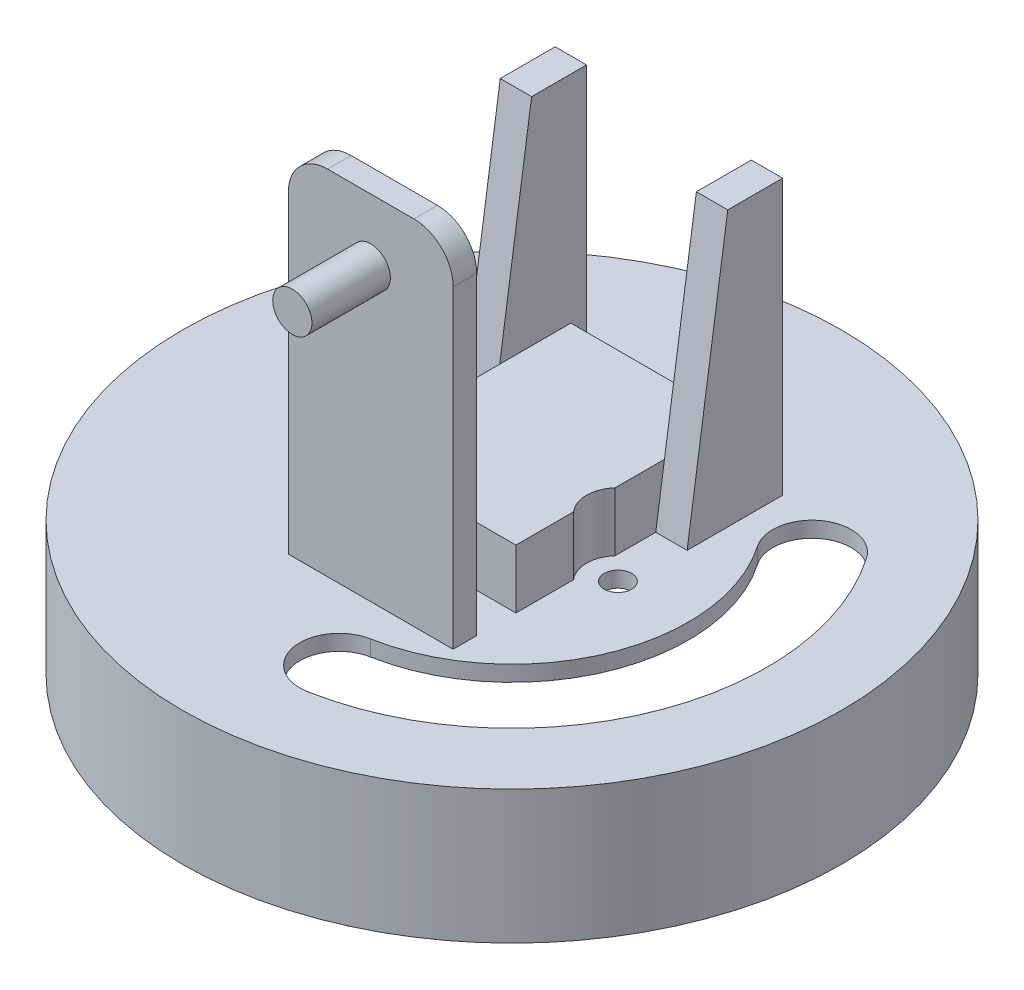
from build123d import *

# Parameters (mm, degrees)
IZIM1_R                     = 42
IZIM1_R_2                   = 40
Y_KSEKLIK_EKSTR_ZYON1_DEPTH = 15
IZIM2_R                     = 42
Y_KSEKLIK_EKSTR_ZYON2_DEPTH = 2
IZIM3_R                     = 1.75
KES_EKSTR_ZYON1_DEPTH       = 2
KES_EKSTR_ZYON2_DEPTH       = 2
Y_KSEKLIK_EKSTR_ZYON3_DEPTH = 7.5
Y_KSEKLIK_EKSTR_ZYON4_DEPTH = 35
Y_KSEKLIK_EKSTR_ZYON5_DEPTH = 4
Y_KSEKLIK_EKSTR_ZYON6_DEPTH = 4
IZIM9_W                     = 21
IZIM9_H                     = 3
Y_KSEKLIK_EKSTR_ZYON7_DEPTH = 45
IZIM10_R                    = 2.5
Y_KSEKLIK_EKSTR_ZYON8_DEPTH = 10
RADYUS1_R                   = 5


with BuildPart() as part:
    # Çizim1 → Yükseklik-Ekstrüzyon1 (new body)
    with BuildSketch(Plane(origin=(0, 0, 0), x_dir=(1, 0, 0), z_dir=(0, 1, 0))):
        with Locations(Location((0, 0, 0), (0, 0, 270))):
            Circle(IZIM1_R)
        with Locations(Location((0, 0, 0), (0, 0, 270))):
            Circle(IZIM1_R_2, mode=Mode.SUBTRACT)
    extrude(amount=Y_KSEKLIK_EKSTR_ZYON1_DEPTH)

    # Çizim2 → Yükseklik-Ekstrüzyon2 (add)
    with BuildSketch(Plane(origin=(0, 15, 0), x_dir=(1, 0, 0), z_dir=(0, 1, 0))):
        with Locations(Location((0, 0, 0), (0, 0, 270))):
            Circle(IZIM2_R)
    extrude(amount=Y_KSEKLIK_EKSTR_ZYON2_DEPTH)

    # Çizim3 → Kes-Ekstrüzyon1 (cut)
    with BuildSketch(Plane(origin=(0, 17, 0), x_dir=(1, 0, 0), z_dir=(0, 1, 0))):
        with Locations(Location((-13.5, 0, 0), (0, 0, 270))):
            Circle(IZIM3_R)
        with Locations(Location((13.5, 0, 0), (0, 0, 270))):
            Circle(IZIM3_R)
    extrude(amount=-KES_EKSTR_ZYON1_DEPTH, mode=Mode.SUBTRACT)

    # Çizim4 → Kes-Ekstrüzyon2 (cut)
    with BuildSketch(Plane(origin=(0, 17, 0), x_dir=(1, 0, 0), z_dir=(0, 1, 0))):
        with BuildLine():
            ThreePointArc((19.121323176, 19.121323176), (23.11330853, 20.564910887), (26.776285642, 18.419569137))
            ThreePointArc((26.776285642, 18.419569137), (30.026084807, -12.437211552), (5.909090909, -31.958295396))
            ThreePointArc((5.909090909, -31.958295396), (1.801989255, -30.88516514), (0, -27.041634566))
            ThreePointArc((0, -27.041634566), (1.156469426, -23.843623821), (4.090909091, -22.124973736))
            ThreePointArc((4.090909091, -22.124973736), (20.787289482, -8.610377228), (18.537428522, 12.752009403))
            ThreePointArc((18.537428522, 12.752009403), (17.677735465, 16.042240718), (19.121323176, 19.121323176))
        make_face()
    extrude(amount=-KES_EKSTR_ZYON2_DEPTH, mode=Mode.SUBTRACT)

    # Çizim5 → Yükseklik-Ekstrüzyon3 (add)
    with BuildSketch(Plane(origin=(0, 17, 0), x_dir=(1, 0, 0), z_dir=(0, 1, 0))):
        with BuildLine():
            Line((-10.5, -10), (-10.5, -2.645751311))
            ThreePointArc((-10.5, -2.645751311), (-9.5, 0), (-10.5, 2.645751311))
            Line((-10.5, 2.645751311), (-10.5, 18))
            Line((-10.5, 18), (10.5, 18))
            Line((10.5, 18), (10.5, 2.645751311))
            ThreePointArc((10.5, 2.645751311), (9.5, 0), (10.5, -2.645751311))
            Line((10.5, -2.645751311), (10.5, -10))
            Line((10.5, -10), (-10.5, -10))
        make_face()
    extrude(amount=Y_KSEKLIK_EKSTR_ZYON3_DEPTH)

    # Çizim6 → Yükseklik-Ekstrüzyon4 (add)
    with BuildSketch(Plane(origin=(0, 17, 0), x_dir=(1, 0, 0), z_dir=(0, 1, 0))):
        Polygon((-10.5, 18), (-10.5, 13), (-14.5, 13), (-14.5, 20), (-10.5, 20), align=None)
        Polygon((10.5, 20), (10.5, 18), (10.5, 13), (14.5, 13), (14.5, 20), align=None)
    extrude(amount=Y_KSEKLIK_EKSTR_ZYON4_DEPTH)

    # Çizim7 → Yükseklik-Ekstrüzyon5 (add)
    with BuildSketch(Plane(origin=(10.5, 0, 0), x_dir=(0, 0, -1), z_dir=(1, 0, 0))):
        Polygon((13, 52), (7.822875656, 17), (13, 17), align=None)
    extrude(amount=Y_KSEKLIK_EKSTR_ZYON5_DEPTH)

    # Çizim8 → Yükseklik-Ekstrüzyon6 (add)
    with BuildSketch(Plane.ZY.offset(10.5)):
        Polygon((-13, 52), (-7.822875656, 17), (-13, 17), align=None)
    extrude(amount=Y_KSEKLIK_EKSTR_ZYON6_DEPTH)

    # Çizim9 → Yükseklik-Ekstrüzyon7 (add)
    with BuildSketch(Plane(origin=(0, 17, 0), x_dir=(1, 0, 0), z_dir=(0, 1, 0))):
        with Locations((0, -16.5)):
            Rectangle(IZIM9_W, IZIM9_H)
    extrude(amount=Y_KSEKLIK_EKSTR_ZYON7_DEPTH)

    # Çizim10 → Yükseklik-Ekstrüzyon8 (add)
    with BuildSketch(Plane.XY.offset(18)):
        with Locations(Location((0, 54, 0), (0, 0, 180))):
            Circle(IZIM10_R)
    extrude(amount=Y_KSEKLIK_EKSTR_ZYON8_DEPTH)

    # Radyus1
    radyus1_edges = [part.edges().sort_by_distance(p)[0] for p in [
        (-10.5, 62, 16.5),
        (10.5, 62, 16.5),
    ]]
    fillet(radyus1_edges, radius=RADYUS1_R)


solid = part.part
